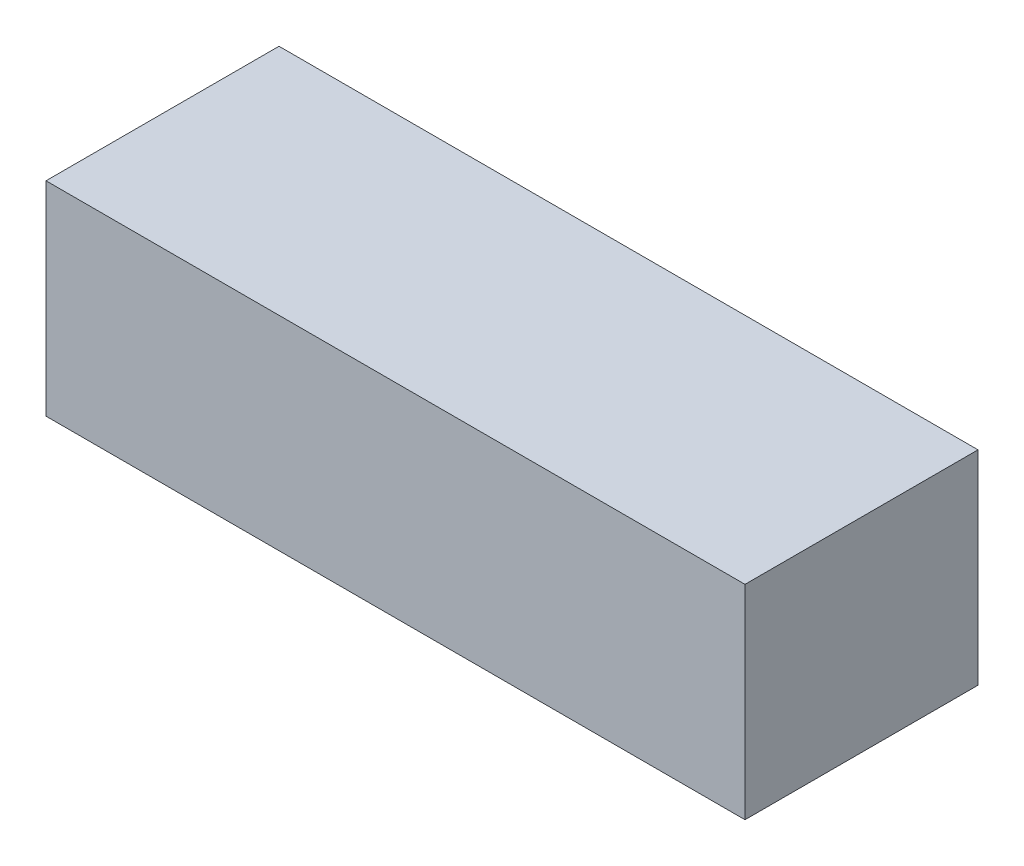
from build123d import *

# Parameters (mm, degrees)
SKETCH1_W           = 609.6
SKETCH1_H           = 203.2
BOSS_EXTRUDE1_DEPTH = 177.8


with BuildPart() as part:
    # Sketch1 → Boss-Extrude1 (new body)
    with BuildSketch(Plane(origin=(0, 0, 0), x_dir=(1, 0, 0), z_dir=(0, 1, 0))):
        with Locations((304.8, 101.6)):
            Rectangle(SKETCH1_W, SKETCH1_H)
    extrude(amount=BOSS_EXTRUDE1_DEPTH)


solid = part.part
